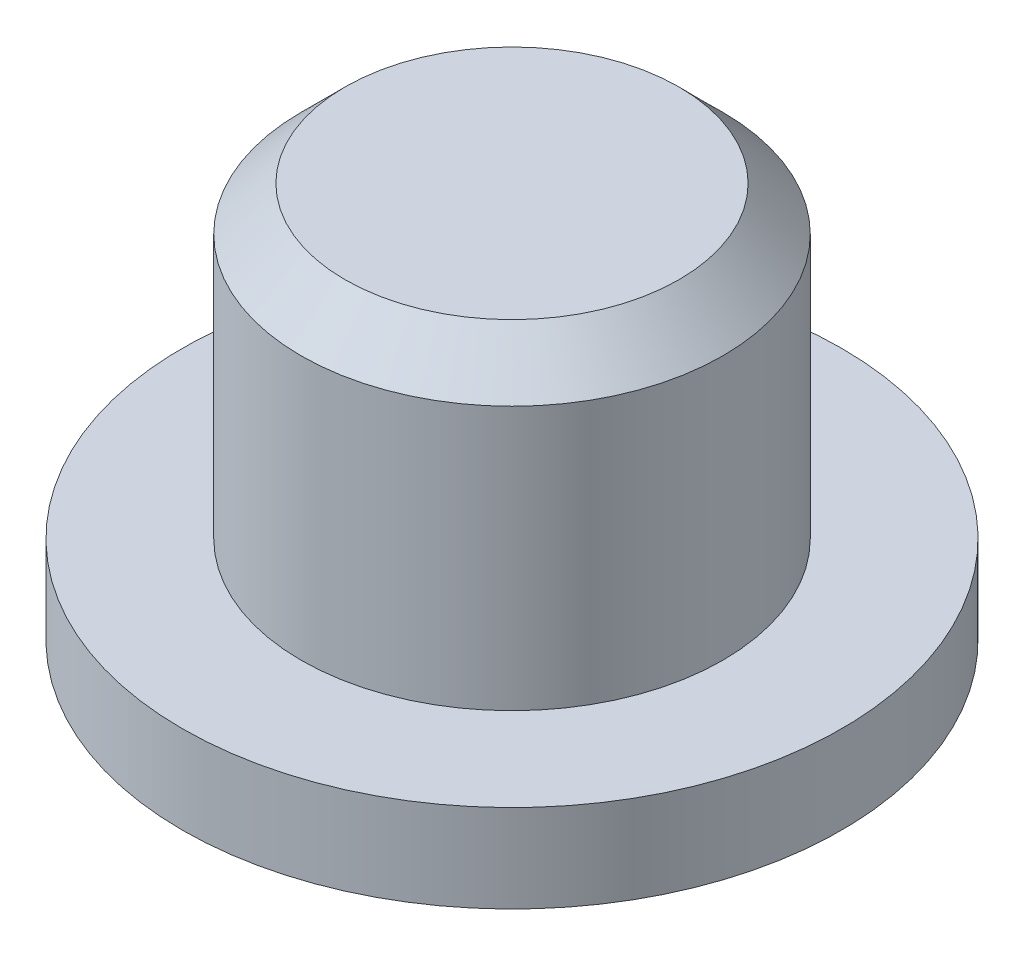
from build123d import *

# Parameters (mm, degrees)
SKETCH1_R           = 4.8
BOSS_EXTRUDE1_DEPTH = 9
SKETCH2_R           = 7.5
BOSS_EXTRUDE2_DEPTH = 2
CHAMFER1_SIZE       = 1


with BuildPart() as part:
    # Sketch1 → Boss-Extrude1 (new body)
    with BuildSketch(Plane(origin=(0, 0, 0), x_dir=(1, 0, 0), z_dir=(0, 1, 0))):
        with Locations(Location((0, 0, 0), (0, 0, 270))):
            Circle(SKETCH1_R)
    extrude(amount=BOSS_EXTRUDE1_DEPTH)

    # Sketch2 → Boss-Extrude2 (add)
    with BuildSketch(Plane.XZ):
        with Locations(Location((0, 0, 0), (0, 0, 270))):
            Circle(SKETCH2_R)
    extrude(amount=-BOSS_EXTRUDE2_DEPTH)

    # Chamfer1
    chamfer1_edges = [part.edges().sort_by_distance(p)[0] for p in [
        (0, 9, -4.8),
    ]]
    chamfer(chamfer1_edges, length=CHAMFER1_SIZE)


solid = part.part
